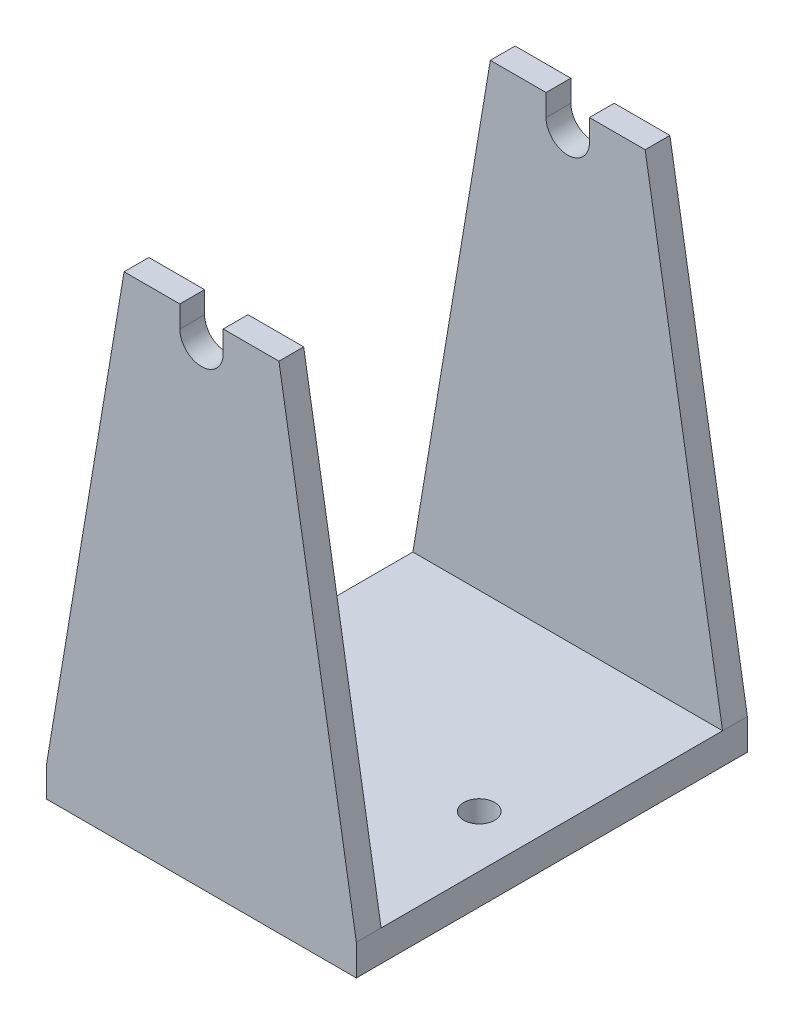
from build123d import *

# Parameters (mm, degrees)
ESTRUSIONE_ESTRUSIONE1_DEPTH = 4
SCHIZZO2_W                   = 50
SCHIZZO2_H                   = 5
ESTRUSIONE_ESTRUSIONE2_DEPTH = 55.13
ESTRUSIONE_ESTRUSIONE3_DEPTH = 4
FORO_PER_VITE_M5_1_D         = 5


with BuildPart() as part:
    # Schizzo1 → Estrusione-Estrusione1 (new body)
    with BuildSketch(Plane.XY):
        with BuildLine():
            Line((-25, 0), (25, 0))
            Line((25, 0), (25, 5))
            Line((25, 5), (12.5, 80))
            Line((12.5, 80), (3.5, 80))
            Line((3.5, 80), (3.5, 76.5))
            ThreePointArc((3.5, 76.5), (0, 73), (-3.5, 76.5))
            Line((-3.5, 76.5), (-3.5, 80))
            Line((-3.5, 80), (-12.5, 80))
            Line((-12.5, 80), (-25, 5))
            Line((-25, 5), (-25, 0))
        make_face()
    extrude(amount=ESTRUSIONE_ESTRUSIONE1_DEPTH)

    # Schizzo2 → Estrusione-Estrusione2 (add)
    with BuildSketch(Plane.XY.offset(4)):
        with Locations((0, 2.5)):
            Rectangle(SCHIZZO2_W, SCHIZZO2_H)
    extrude(amount=ESTRUSIONE_ESTRUSIONE2_DEPTH)

    # Schizzo3 → Estrusione-Estrusione3 (add)
    with BuildSketch(Plane.XY.offset(59.13)):
        with BuildLine():
            Line((3.5, 80), (3.5, 76.5))
            ThreePointArc((3.5, 76.5), (0, 73), (-3.5, 76.5))
            Line((-3.5, 76.5), (-3.5, 80))
            Line((-3.5, 80), (-12.5, 80))
            Line((-12.5, 80), (-25, 5))
            Line((-25, 5), (-25, 0))
            Line((-25, 0), (25, 0))
            Line((25, 0), (25, 5))
            Line((25, 5), (12.5, 80))
            Line((12.5, 80), (3.5, 80))
        make_face()
    extrude(amount=ESTRUSIONE_ESTRUSIONE3_DEPTH)

    # Foro per Vite M5-1 (through all)
    with Locations(Plane(origin=(658.388856913, -5, 71.018331699), x_dir=(-0.2836975166298168, 0, -0.9589138225398959), z_dir=(0, -1, 0))):
        with Locations((223.786948804, -629.129350035), (216.694510888, -605.156504471)):
            Hole(FORO_PER_VITE_M5_1_D / 2)


solid = part.part
